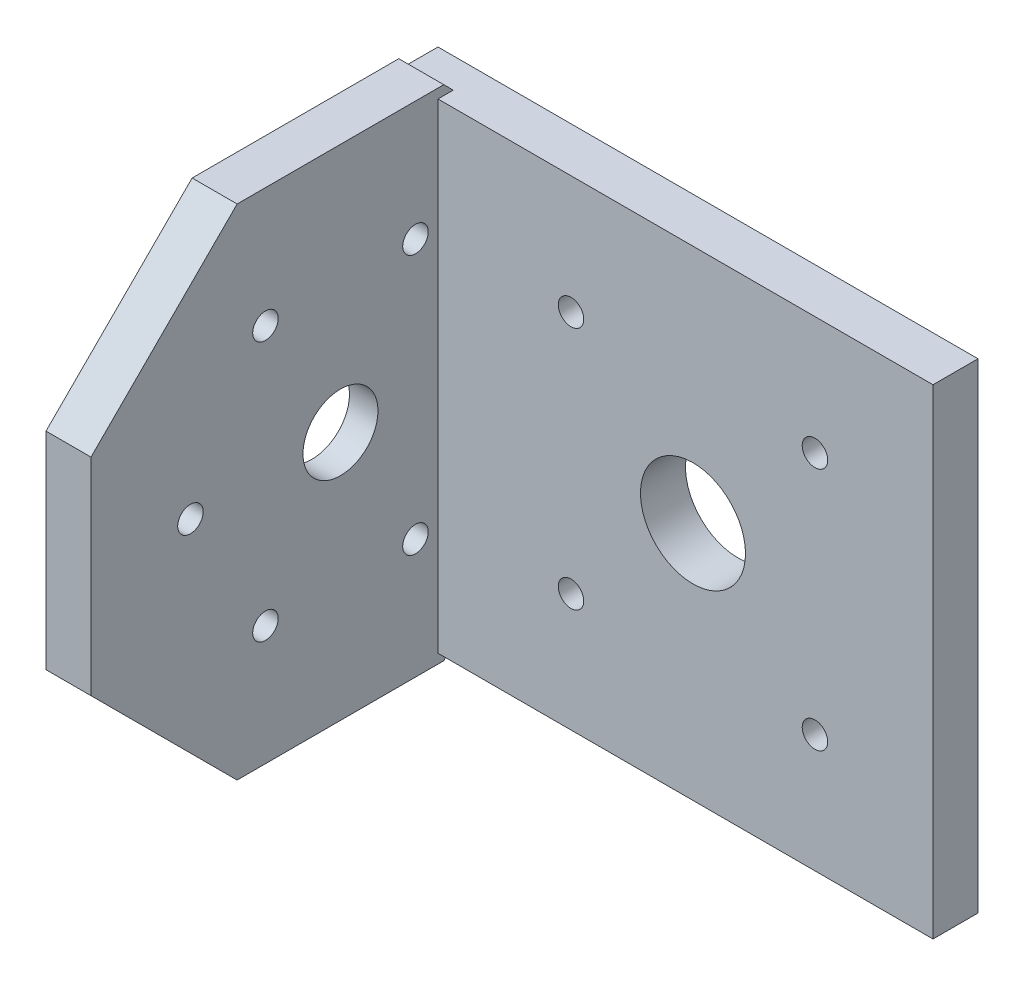
from build123d import *

# Parameters (mm, degrees)
SK_ROLL_PLATE_R         = 1.7
SK_ROLL_PLATE_R_2       = 5
ROLL_PLATE_DEPTH        = 6
SK_YAW_PLATE_W          = 72
SK_YAW_PLATE_H          = 64
SK_YAW_PLATE_R          = 1.7
SK_YAW_PLATE_R_2        = 7
YAW_PLATE_DEPTH         = 6
SK_ROLL_PILOT_RECESS_R  = 15.15
ROLL_PILOT_RECESS_DEPTH = 2.2


with BuildPart() as part:
    # SK_Roll_Plate → Roll_Plate (new body)
    with BuildSketch(Plane(origin=(-40, 0, 0), x_dir=(0, 0, -1), z_dir=(1, 0, 0))):
        Polygon((-13.776603565, -33.25966317), (-33.25966317, -13.776603565), (-33.25966317, 13.776603565), (-13.776603565, 33.25966317), (13.776603565, 33.25966317), (33.25966317, 13.776603565), (33.25966317, -13.776603565), (13.776603565, -33.25966317), align=None)
        with Locations((20, 0)):
            Circle(SK_ROLL_PLATE_R, mode=Mode.SUBTRACT)
        with Locations((10, -17.320508076)):
            Circle(SK_ROLL_PLATE_R, mode=Mode.SUBTRACT)
        with Locations((-10, -17.320508076)):
            Circle(SK_ROLL_PLATE_R, mode=Mode.SUBTRACT)
        with Locations((-20, 0)):
            Circle(SK_ROLL_PLATE_R, mode=Mode.SUBTRACT)
        with Locations((-10, 17.320508076)):
            Circle(SK_ROLL_PLATE_R, mode=Mode.SUBTRACT)
        with Locations((10, 17.320508076)):
            Circle(SK_ROLL_PLATE_R, mode=Mode.SUBTRACT)
        Circle(SK_ROLL_PLATE_R_2, mode=Mode.SUBTRACT)
    extrude(amount=ROLL_PLATE_DEPTH)

    # SK_Yaw_Plate → Yaw_Plate (add)
    with BuildSketch(Plane.XY.offset(-19)):
        with Locations((-4, 0)):
            Rectangle(SK_YAW_PLATE_W, SK_YAW_PLATE_H)
        with Locations((16.263455967, -16.263455967)):
            Circle(SK_YAW_PLATE_R, mode=Mode.SUBTRACT)
        with Locations((-16.263455967, -16.263455967)):
            Circle(SK_YAW_PLATE_R, mode=Mode.SUBTRACT)
        with Locations((-16.263455967, 16.263455967)):
            Circle(SK_YAW_PLATE_R, mode=Mode.SUBTRACT)
        with Locations((16.263455967, 16.263455967)):
            Circle(SK_YAW_PLATE_R, mode=Mode.SUBTRACT)
        Circle(SK_YAW_PLATE_R_2, mode=Mode.SUBTRACT)
    extrude(amount=YAW_PLATE_DEPTH)

    # SK_Roll_Pilot_Recess → Roll_Pilot_Recess (cut)
    with BuildSketch(Plane(origin=(-40, 0, 0), x_dir=(0, 0, -1), z_dir=(1, 0, 0))):
        Circle(SK_ROLL_PILOT_RECESS_R)
    extrude(amount=ROLL_PILOT_RECESS_DEPTH, mode=Mode.SUBTRACT)


solid = part.part
